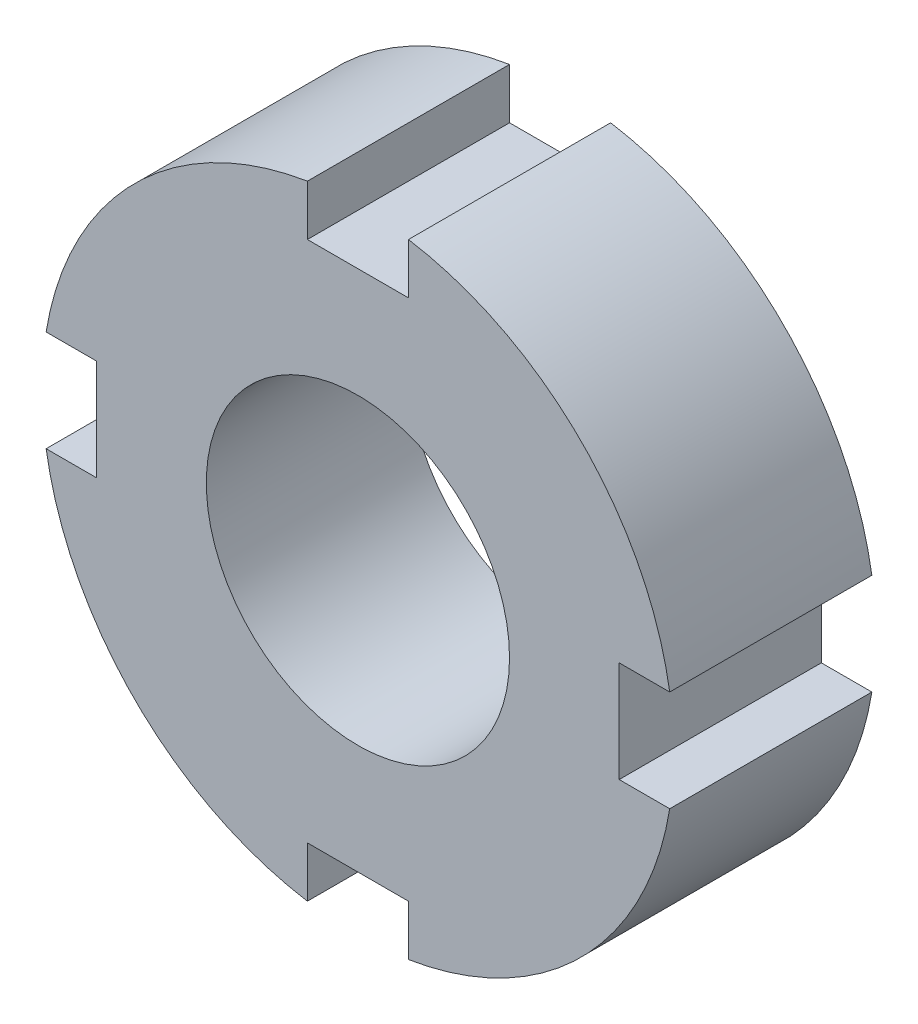
from build123d import *

# Parameters (mm, degrees)
ESBO_O1_R                = 6
RESSALTO_EXTRUS_O1_DEPTH = 8


with BuildPart() as part:
    # Esboço1 → Ressalto-extrusão1 (new body)
    with BuildSketch(Plane.XY):
        with BuildLine():
            Line((2, 10.338962679), (-2, 10.338962679))
            Line((-2, 10.338962679), (-2, 12.338962679))
            ThreePointArc((-2, 12.338962679), (-8.838834765, 8.838834765), (-12.338962679, 2))
            Line((-12.338962679, 2), (-10.338962679, 2))
            Line((-10.338962679, 2), (-10.338962679, -2))
            Line((-10.338962679, -2), (-12.338962679, -2))
            ThreePointArc((-12.338962679, -2), (-8.838834765, -8.838834765), (-2, -12.338962679))
            Line((-2, -12.338962679), (-2, -10.338962679))
            Line((-2, -10.338962679), (2, -10.338962679))
            Line((2, -10.338962679), (2, -12.338962679))
            ThreePointArc((2, -12.338962679), (8.838834765, -8.838834765), (12.338962679, -2))
            Line((12.338962679, -2), (10.338962679, -2))
            Line((10.338962679, -2), (10.338962679, 2))
            Line((10.338962679, 2), (12.338962679, 2))
            ThreePointArc((12.338962679, 2), (8.838834765, 8.838834765), (2, 12.338962679))
            Line((2, 12.338962679), (2, 10.338962679))
        make_face()
        Circle(ESBO_O1_R, mode=Mode.SUBTRACT)
    extrude(amount=RESSALTO_EXTRUS_O1_DEPTH)


solid = part.part
